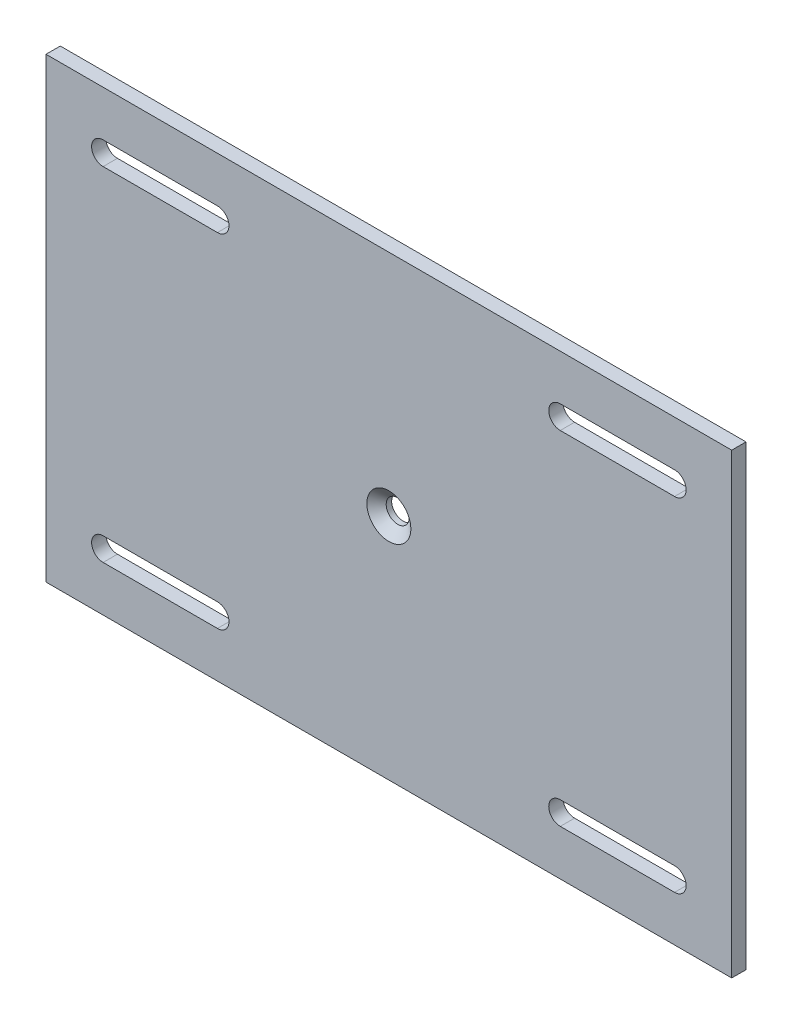
from build123d import *

# Parameters (mm, degrees)
SKETCH1_W            = 152.4
SKETCH1_H            = 101.6
BOSS_EXTRUDE1_DEPTH  = 3.175
CUT_EXTRUDE1_DEPTH   = 92.636022529
MIRROR2_COPY_1_DEPTH = 92.636022529


with BuildPart() as part:
    # Sketch1 → Boss-Extrude1 (new body)
    with BuildSketch(Plane.XY):
        Rectangle(SKETCH1_W, SKETCH1_H)
    extrude(amount=BOSS_EXTRUDE1_DEPTH)

    # Sketch2 → Cut-Extrude1 (cut, symmetric)
    with BuildSketch(Plane.XY.offset(3.175)):
        with BuildLine():
            Line((-63.5, 40.665937046), (-38.1, 40.665937046))
            ThreePointArc((-38.1, 40.665937046), (-35.534062954, 38.1), (-38.1, 35.534062954))
            Line((-38.1, 35.534062954), (-63.5, 35.534062954))
            ThreePointArc((-63.5, 35.534062954), (-66.065937046, 38.1), (-63.5, 40.665937046))
        make_face()
    cut_extrude1 = extrude(amount=CUT_EXTRUDE1_DEPTH, both=True, mode=Mode.SUBTRACT)

    # Mirror1: Cut-Extrude1 across plane
    add(cut_extrude1.mirror(Plane(origin=(0, 0, 0), x_dir=(0, 0, 1), z_dir=(1, 0, 0))), mode=Mode.SUBTRACT)

    # Mirror2: Cut-Extrude1 across plane
    add(cut_extrude1.mirror(Plane.ZX), mode=Mode.SUBTRACT)

    # Mirror2 copy 1 sketch → Mirror2 copy 1 (cut, symmetric)
    with BuildSketch(Plane(origin=(0, 0, 3.175), x_dir=(-1, 0, 0), z_dir=(0, 0, 1))):
        with BuildLine():
            Line((-63.5, 40.665937046), (-38.1, 40.665937046))
            ThreePointArc((-38.1, 40.665937046), (-35.534062954, 38.1), (-38.1, 35.534062954))
            Line((-38.1, 35.534062954), (-63.5, 35.534062954))
            ThreePointArc((-63.5, 35.534062954), (-66.065937046, 38.1), (-63.5, 40.665937046))
        make_face()
    extrude(amount=MIRROR2_COPY_1_DEPTH, both=True, mode=Mode.SUBTRACT)

    # Sketch5 → CSK for #10 Flat Head Machine Screw (100)1 (revolve, cut)
    with BuildSketch(Plane(origin=(0, 0, 3.175), x_dir=(0, -1, 0), z_dir=(1, 0, 0))):
        Polygon((0, 0), (0, 3.175), (2.5527, 3.175), (2.5527, 1.960808018), (4.8895, 0), align=None)
    revolve(axis=Axis((0, 0, 9.525), (0, 0, -1)), mode=Mode.SUBTRACT)


solid = part.part
